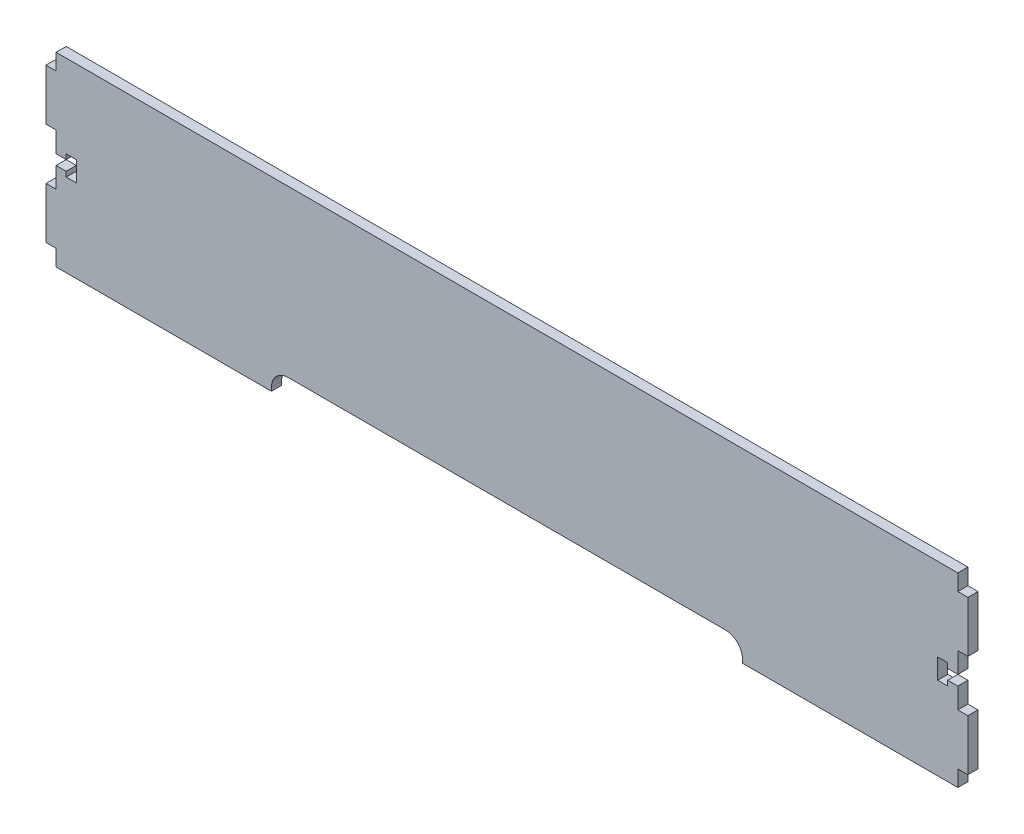
from build123d import *

# Parameters (mm, degrees)
SALIENTE_EXTRUIR1_DEPTH = 3
CROQUIS2_W              = 3
CROQUIS2_H              = 15.2
SALIENTE_EXTRUIR2_DEPTH = 3
CROQUIS3_W              = 3
CROQUIS3_H              = 15.2
SALIENTE_EXTRUIR3_DEPTH = 3


with BuildPart() as part:
    # Croquis1 → Saliente-Extruir1 (new body)
    with BuildSketch(Plane.XY):
        with BuildLine():
            Line((134, -27.625), (70, -27.625))
            Line((70, -27.625), (70, -26.595))
            ThreePointArc((70, -26.595), (68.535533906, -23.059466094), (65, -21.595))
            Line((65, -21.595), (-65, -21.595))
            ThreePointArc((-65, -21.595), (-68.535533906, -23.059466094), (-70, -26.595))
            Line((-70, -26.595), (-70, -27.625))
            Line((-70, -27.625), (-134, -27.625))
            Line((-134, -27.625), (-134, -1.5))
            Line((-134, -1.5), (-131, -1.5))
            Line((-131, -1.5), (-131, -3))
            Line((-131, -3), (-128, -3))
            Line((-128, -3), (-128, 3))
            Line((-128, 3), (-131, 3))
            Line((-131, 3), (-131, 1.5))
            Line((-131, 1.5), (-134, 1.5))
            Line((-134, 1.5), (-134, 27.625))
            Line((-134, 27.625), (134, 27.625))
            Line((134, 27.625), (134, 1.5))
            Line((134, 1.5), (131, 1.5))
            Line((131, 1.5), (131, 3))
            Line((131, 3), (128, 3))
            Line((128, 3), (128, -3))
            Line((128, -3), (131, -3))
            Line((131, -3), (131, -1.5))
            Line((131, -1.5), (134, -1.5))
            Line((134, -1.5), (134, -27.625))
        make_face()
    extrude(amount=SALIENTE_EXTRUIR1_DEPTH)

    # Croquis2 → Saliente-Extruir2 (add)
    with BuildSketch(Plane(origin=(134, 0, 0), x_dir=(0, 0, -1), z_dir=(1, 0, 0))):
        with Locations((-1.5, 15.225)):
            Rectangle(CROQUIS2_W, CROQUIS2_H)
        with Locations((-1.5, -15.225)):
            Rectangle(CROQUIS2_W, CROQUIS2_H)
    extrude(amount=SALIENTE_EXTRUIR2_DEPTH)

    # Croquis3 → Saliente-Extruir3 (add)
    with BuildSketch(Plane.ZY.offset(134)):
        with Locations((1.5, 15.225)):
            Rectangle(CROQUIS3_W, CROQUIS3_H)
        with Locations((1.5, -15.225)):
            Rectangle(CROQUIS3_W, CROQUIS3_H)
    extrude(amount=SALIENTE_EXTRUIR3_DEPTH)


solid = part.part
